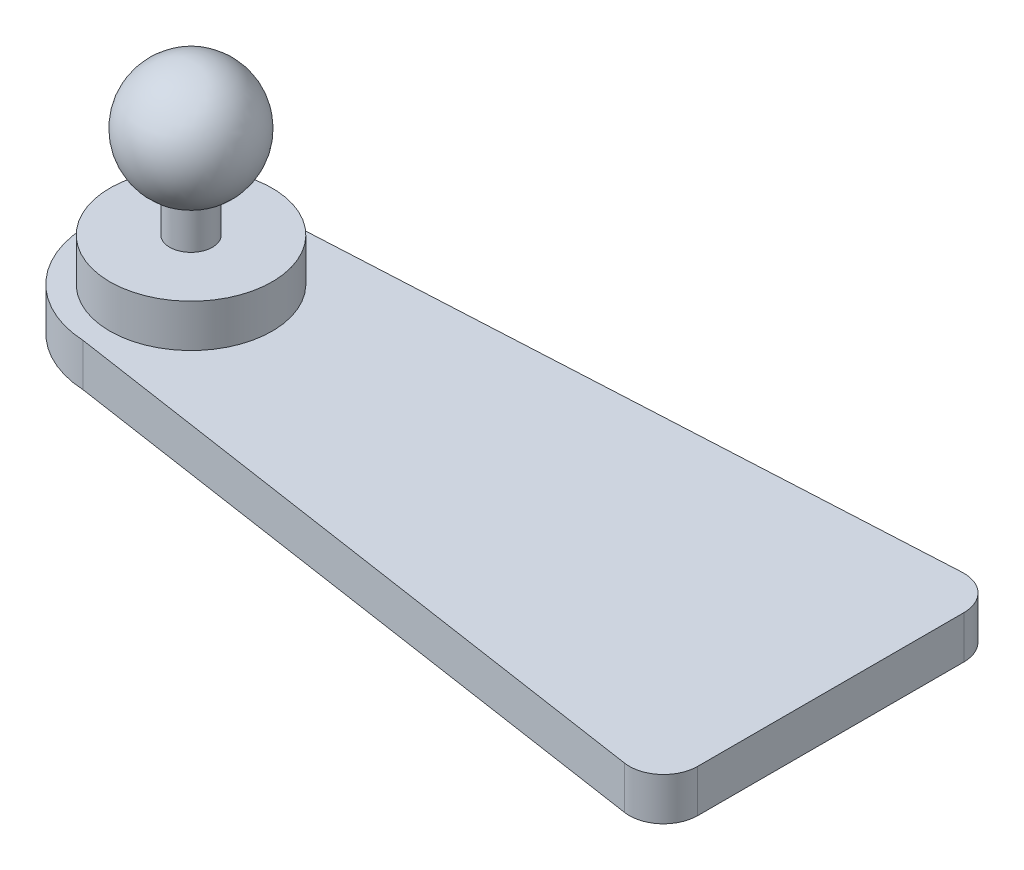
from build123d import *

# Parameters (mm, degrees)
BOSS_EXTRUDE1_DEPTH = 3.175
FILLET1_R           = 2.54
SKETCH2_R           = 6.0325
BOSS_EXTRUDE3_DEPTH = 3.175
SKETCH3_R           = 1.5875
BOSS_EXTRUDE4_DEPTH = 3.175


with BuildPart() as part:
    # Sketch1 → Boss-Extrude1 (new body)
    with BuildSketch(Plane(origin=(0, 0, 0), x_dir=(1, 0, 0), z_dir=(0, 1, 0))):
        with BuildLine():
            Line((15.837639572, 15.574796876), (15.837639572, -9.825203124))
            Line((15.837639572, -9.825203124), (-34.402531646, -2.304219409))
            ThreePointArc((-34.402531646, -2.304219409), (-41.632773479, 5.315780591), (-34.402531646, 12.935780591))
            Line((-34.402531646, 12.935780591), (15.837639572, 15.574796876))
        make_face()
    extrude(amount=BOSS_EXTRUDE1_DEPTH)

    # Fillet1
    fillet1_edges = [part.edges().sort_by_distance(p)[0] for p in [
        (15.837639572, 1.5875, -15.574796876),
        (15.837639572, 1.5875, 9.825203124),
    ]]
    fillet(fillet1_edges, radius=FILLET1_R)

    # Sketch2 → Boss-Extrude3 (add)
    with BuildSketch(Plane(origin=(0, 3.175, 0), x_dir=(1, 0, 0), z_dir=(0, 1, 0))):
        with Locations(Location((-34.002268199, 5.315780591, 0), (0, 0, 270))):
            Circle(SKETCH2_R)
    extrude(amount=BOSS_EXTRUDE3_DEPTH)

    # Sketch3 → Boss-Extrude4 (add)
    with BuildSketch(Plane(origin=(0, 6.35, 0), x_dir=(1, 0, 0), z_dir=(0, 1, 0))):
        with Locations(Location((-34.002268199, 5.315780591, 0), (0, 0, 270))):
            Circle(SKETCH3_R)
    extrude(amount=BOSS_EXTRUDE4_DEPTH)

    # Sketch6 → Revolve1 (revolve)
    with BuildSketch(Plane.XY.offset(-5.315780591)):
        with BuildLine():
            Line((-34.008296726, 17.526), (-34.008296726, 8.89))
            ThreePointArc((-34.008296726, 8.89), (-38.326296726, 13.208), (-34.008296726, 17.526))
        make_face()
    revolve(axis=Axis((-34.008296726, 17.526, -5.315780591), (0, -1, 0)))


solid = part.part
